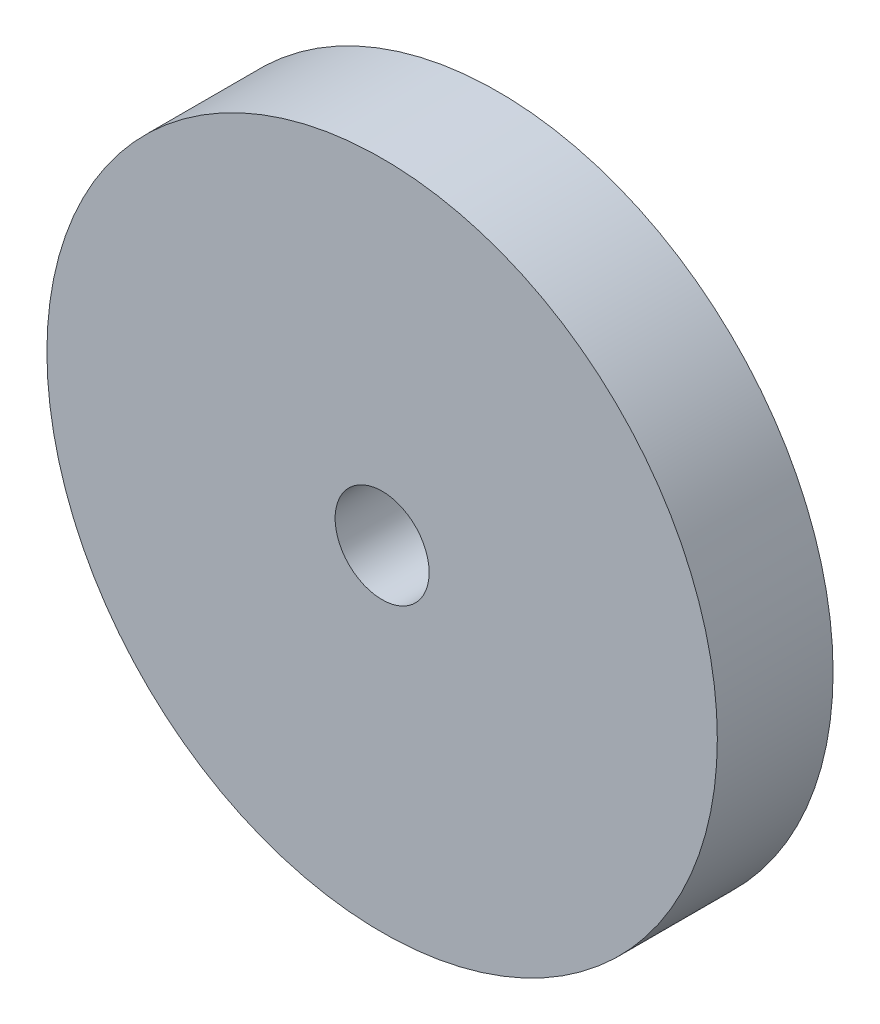
from build123d import *

# Parameters (mm, degrees)
SKETCH1_R           = 17.3736
SKETCH1_R_2         = 2.4365
BOSS_EXTRUDE1_DEPTH = 6


with BuildPart() as part:
    # Sketch1 → Boss-Extrude1 (new body)
    with BuildSketch(Plane.XY):
        Circle(SKETCH1_R)
        Circle(SKETCH1_R_2, mode=Mode.SUBTRACT)
    extrude(amount=BOSS_EXTRUDE1_DEPTH)


solid = part.part
